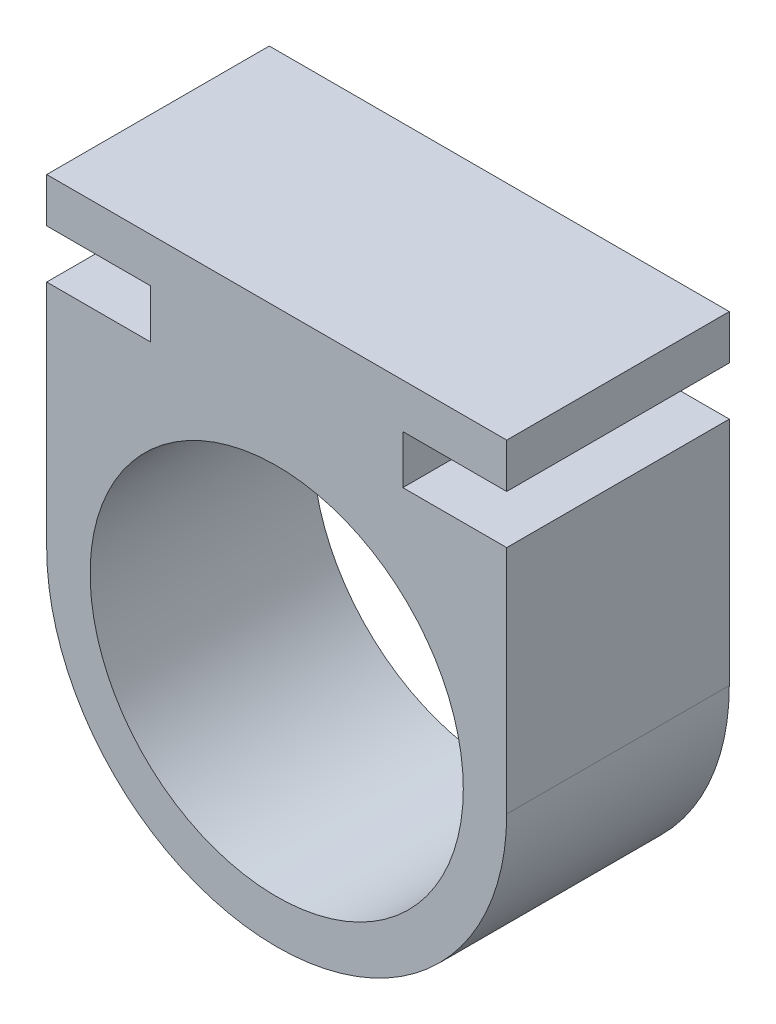
from build123d import *

# Parameters (mm, degrees)
SKETCH1_W           = 7
SKETCH1_H           = 3
SKETCH1_W_2         = 17
SKETCH1_H_2         = 3.275
BOSS_EXTRUDE1_DEPTH = 15


with BuildPart() as part:
    # Sketch1 → Boss-Extrude1 (new body)
    with BuildSketch(Plane.XY):
        with Locations((12, 20.325)):
            Rectangle(SKETCH1_W, SKETCH1_H)
        with Locations((0, 20.325)):
            Rectangle(SKETCH1_W_2, SKETCH1_H)
        with Locations((-12, 20.325)):
            Rectangle(SKETCH1_W, SKETCH1_H)
        with Locations((0, 17.1875)):
            Rectangle(SKETCH1_W_2, SKETCH1_H_2)
        with BuildLine():
            ThreePointArc((-15.5, 0), (0, 15.5), (15.5, 0))
            Line((15.5, 0), (15.5, 15.55))
            Line((15.5, 15.55), (8.5, 15.55))
            Line((8.5, 15.55), (-8.5, 15.55))
            Line((-8.5, 15.55), (-15.5, 15.55))
            Line((-15.5, 15.55), (-15.5, 0))
        make_face()
        with BuildLine():
            ThreePointArc((-12.575, 0), (0, 12.575), (12.575, 0))
            Line((12.575, 0), (15.5, 0))
            ThreePointArc((15.5, 0), (0, 15.5), (-15.5, 0))
            Line((-15.5, 0), (-12.575, 0))
        make_face()
        with BuildLine():
            Line((15.5, 0), (12.575, 0))
            ThreePointArc((12.575, 0), (0, -12.575), (-12.575, 0))
            Line((-12.575, 0), (-15.5, 0))
            ThreePointArc((-15.5, 0), (0, -15.5), (15.5, 0))
        make_face()
    extrude(amount=BOSS_EXTRUDE1_DEPTH)


solid = part.part
